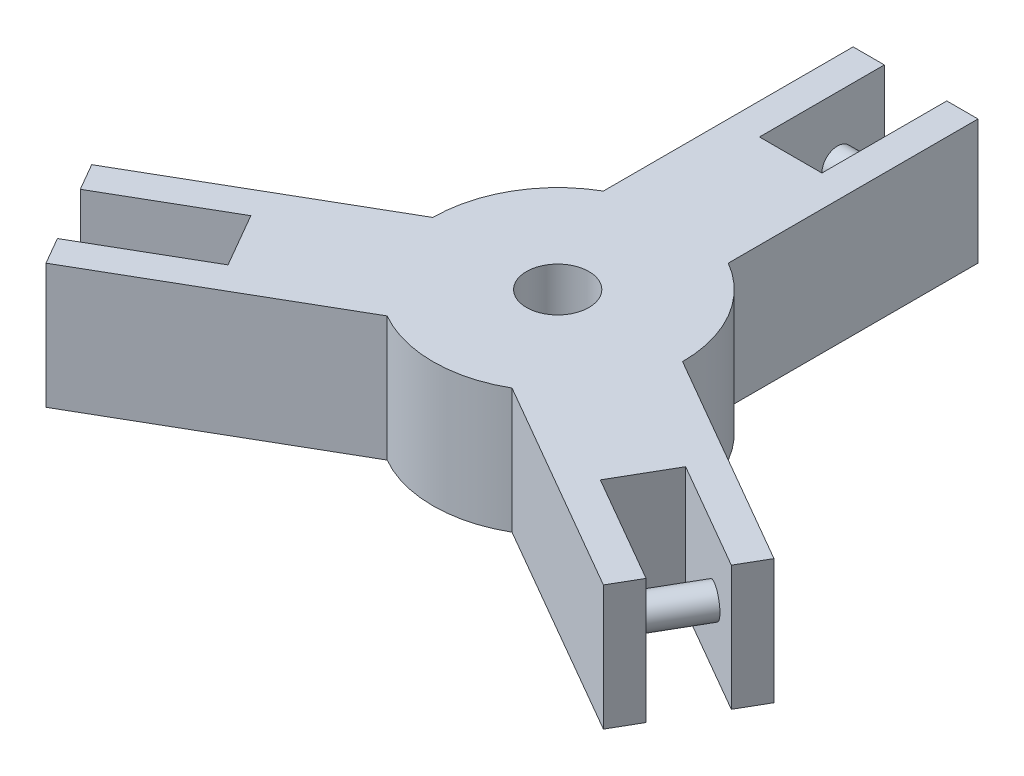
from build123d import *

# Parameters (mm, degrees)
SKETCH1_R           = 10
BOSS_EXTRUDE1_DEPTH = 40
SKETCH2_R           = 5
BOSS_EXTRUDE2_DEPTH = 25
CIRPATTERN1_COUNT   = 3


with BuildPart() as part:
    # Sketch1 → Boss-Extrude1 (new body)
    with BuildSketch(Plane(origin=(0, 0, 0), x_dir=(1, 0, 0), z_dir=(0, 1, 0))):
        with BuildLine():
            Line((-10, 114.641016151), (-20, 114.641016151))
            Line((-20, 114.641016151), (-20, 34.641016151))
            ThreePointArc((-20, 34.641016151), (-34.641016151, 20), (-40, 0))
            Line((-40, 0), (-109.282032303, -40))
            Line((-109.282032303, -40), (-104.282032303, -48.660254038))
            Line((-104.282032303, -48.660254038), (-69.641016151, -28.660254038))
            Line((-69.641016151, -28.660254038), (-59.641016151, -45.980762114))
            Line((-59.641016151, -45.980762114), (-94.282032303, -65.980762114))
            Line((-94.282032303, -65.980762114), (-89.282032303, -74.641016151))
            Line((-89.282032303, -74.641016151), (-20, -34.641016151))
            ThreePointArc((-20, -34.641016151), (0, -40), (20, -34.641016151))
            Line((20, -34.641016151), (89.282032303, -74.641016151))
            Line((89.282032303, -74.641016151), (94.282032303, -65.980762114))
            Line((94.282032303, -65.980762114), (59.641016151, -45.980762114))
            Line((59.641016151, -45.980762114), (69.641016151, -28.660254038))
            Line((69.641016151, -28.660254038), (104.282032303, -48.660254038))
            Line((104.282032303, -48.660254038), (109.282032303, -40))
            Line((109.282032303, -40), (40, 0))
            ThreePointArc((40, 0), (34.641016151, 20), (20, 34.641016151))
            Line((20, 34.641016151), (20, 114.641016151))
            Line((20, 114.641016151), (10, 114.641016151))
            Line((10, 114.641016151), (10, 74.641016151))
            Line((10, 74.641016151), (-10, 74.641016151))
            Line((-10, 74.641016151), (-10, 114.641016151))
        make_face()
        with Locations(Location((0, 0, 0), (0, 0, 270))):
            Circle(SKETCH1_R, mode=Mode.SUBTRACT)
    extrude(amount=BOSS_EXTRUDE1_DEPTH)

    # Sketch2 → Boss-Extrude2 (add)
    with BuildSketch(Plane(origin=(-10, 0, 0), x_dir=(0, 0, -1), z_dir=(1, 0, 0))):
        with Locations((99.641016151, 20)):
            Circle(SKETCH2_R)
    boss_extrude2 = extrude(amount=BOSS_EXTRUDE2_DEPTH)

    # CirPattern1: Boss-Extrude2 ×3 about axis
    cirpattern1_axis = Axis((0, 40, 0), (0, 1, 0))
    for i in range(1, CIRPATTERN1_COUNT):
        add(boss_extrude2.rotate(cirpattern1_axis, i * 360 / CIRPATTERN1_COUNT))


solid = part.part
